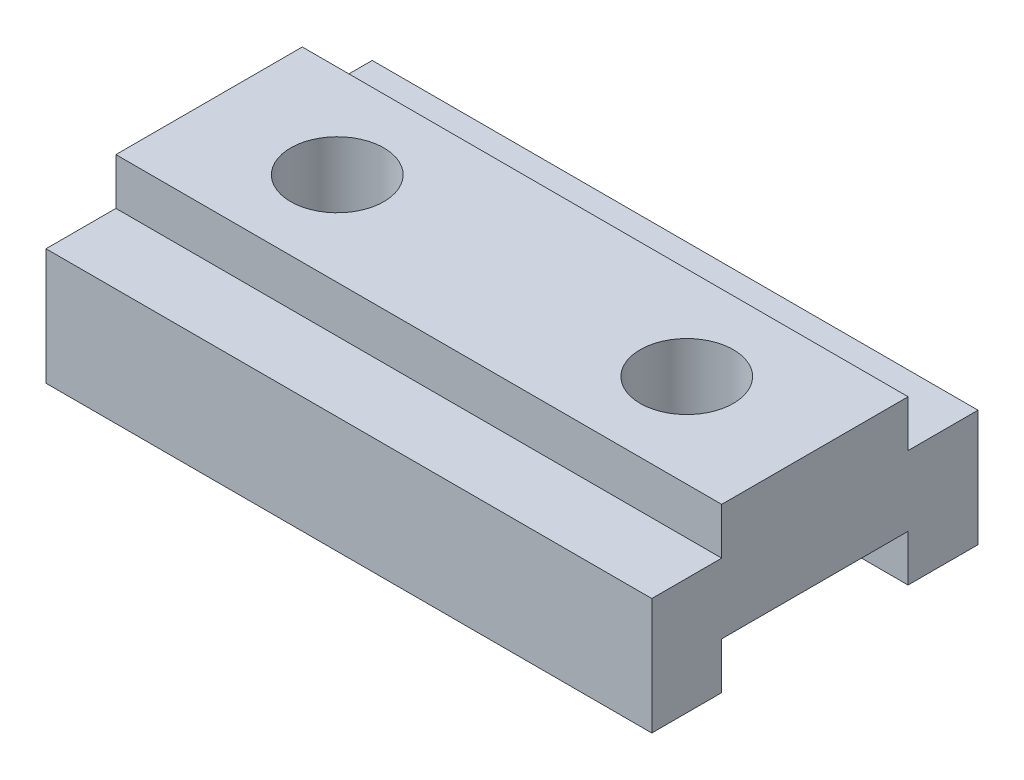
from build123d import *

# Parameters (mm, degrees)
BOSS_EXTRUDE1_DEPTH = 165.1
SKETCH3_R           = 12.7
CUT_EXTRUDE1_DEPTH  = 193.7096845


with BuildPart() as part:
    # Sketch1 → Boss-Extrude1 (new body)
    with BuildSketch(Plane(origin=(0, 0, 0), x_dir=(0, 0, -1), z_dir=(1, 0, 0))):
        Polygon((19.05, 0), (19.05, 12.7), (69.85, 12.7), (69.85, 0), (88.9, 0), (88.9, 31.75), (69.85, 31.75), (69.85, 44.45), (19.05, 44.45), (19.05, 31.75), (0, 31.75), (0, 0), align=None)
    extrude(amount=-BOSS_EXTRUDE1_DEPTH)

    # Sketch3 → Cut-Extrude1 (cut, through all)
    with BuildSketch(Plane(origin=(0, 44.45, 0), x_dir=(1, 0, 0), z_dir=(0, 1, 0))):
        with Locations(Location((-130.175, 44.45, 0), (0, 0, 270))):
            Circle(SKETCH3_R)
        with Locations(Location((-34.925, 44.45, 0), (0, 0, 270))):
            Circle(SKETCH3_R)
    extrude(amount=-CUT_EXTRUDE1_DEPTH, mode=Mode.SUBTRACT)


solid = part.part
